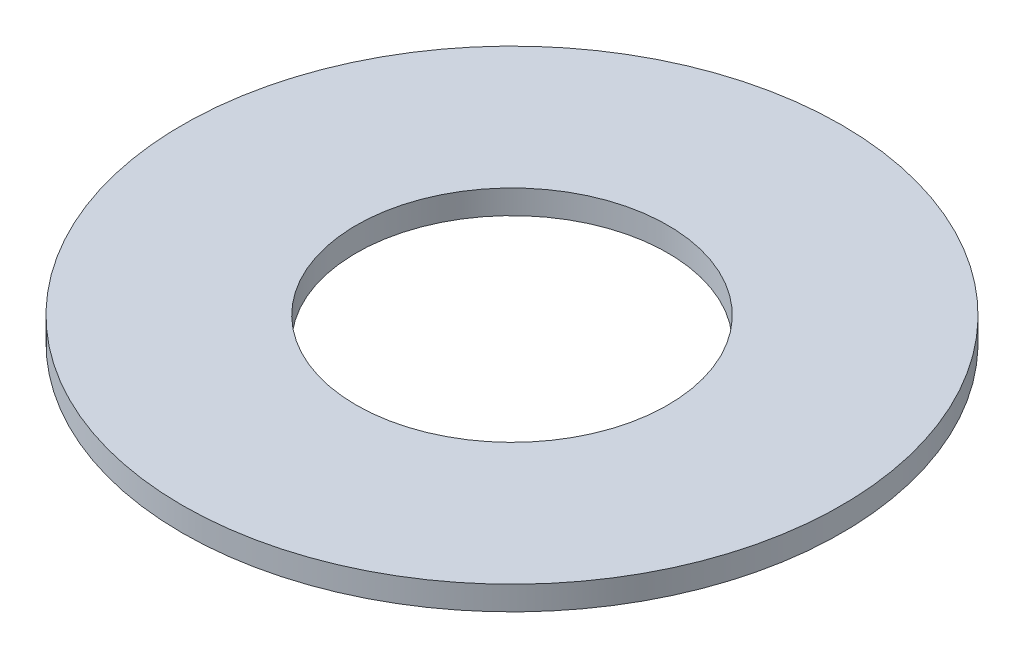
from build123d import *

# Parameters (mm, degrees)
SKETCH_1_R      = 5.5
SKETCH_1_R_2    = 2.6
EXTRUDE_1_DEPTH = 0.4


with BuildPart() as part:
    # 草图1 → 凸台-拉伸1 (new body)
    with BuildSketch(Plane(origin=(0, 0, 0), x_dir=(1, 0, 0), z_dir=(0, 1, 0))):
        with Locations(Location((0, 0, 0), (0, 0, 270))):
            Circle(SKETCH_1_R)
        with Locations(Location((0, 0, 0), (0, 0, 270))):
            Circle(SKETCH_1_R_2, mode=Mode.SUBTRACT)
    extrude(amount=EXTRUDE_1_DEPTH)


solid = part.part
